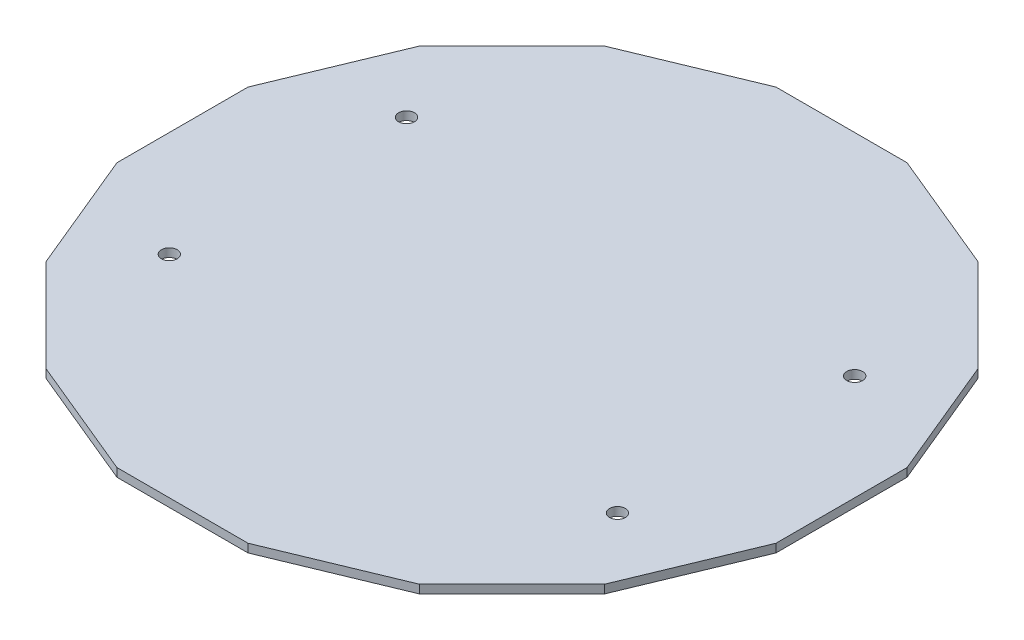
from build123d import *

# Parameters (mm, degrees)
BOSS_EXTRUDE1_DEPTH = 1.6
SKETCH6_R           = 1.5
CUT_EXTRUDE2_DEPTH  = 1.6


with BuildPart() as part:
    # Sketch1 → Boss-Extrude1 (new body)
    with BuildSketch(Plane(origin=(0, 0, 0), x_dir=(1, 0, 0), z_dir=(0, 1, 0))):
        Polygon((62.5, 12.432022961), (52.984941564, 35.403406084), (35.403406084, 52.984941564), (12.432022961, 62.5), (-12.432022961, 62.5), (-35.403406084, 52.984941564), (-52.984941564, 35.403406084), (-62.5, 12.432022961), (-62.5, -12.432022961), (-52.984941564, -35.403406084), (-35.403406084, -52.984941564), (-12.432022961, -62.5), (12.432022961, -62.5), (35.403406084, -52.984941564), (52.984941564, -35.403406084), (62.5, -12.432022961), align=None)
    extrude(amount=BOSS_EXTRUDE1_DEPTH)

    # Sketch6 → Cut-Extrude2 (cut)
    with BuildSketch(Plane(origin=(0, 1.6, 0), x_dir=(1, 0, 0), z_dir=(0, 1, 0))):
        with Locations(Location((-42.5, 22.5, 0), (0, 0, 270))):
            Circle(SKETCH6_R)
        with Locations(Location((-42.5, -22.5, 0), (0, 0, 270))):
            Circle(SKETCH6_R)
        with Locations(Location((42.5, -22.5, 0), (0, 0, 270))):
            Circle(SKETCH6_R)
        with Locations(Location((42.5, 22.5, 0), (0, 0, 270))):
            Circle(SKETCH6_R)
    extrude(amount=-CUT_EXTRUDE2_DEPTH, mode=Mode.SUBTRACT)


solid = part.part
